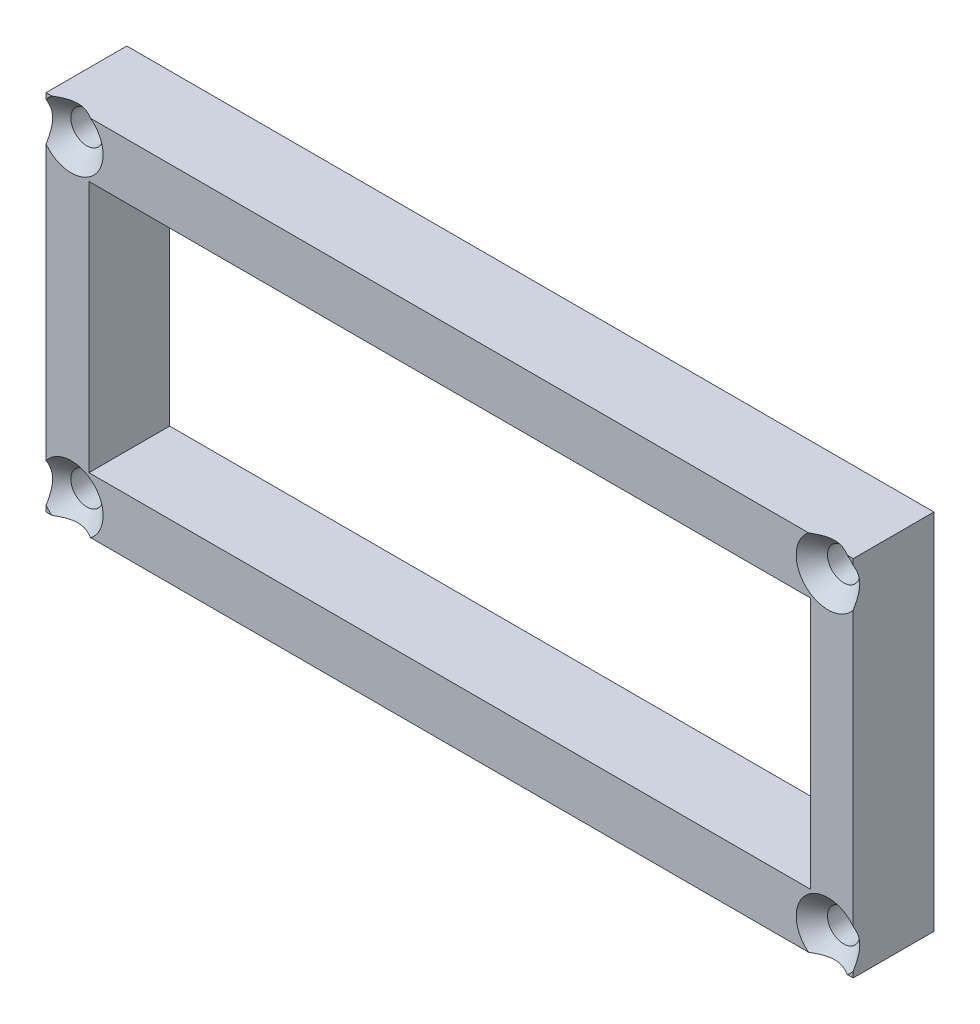
from build123d import *

# Parameters (mm, degrees)
SKETCH2_W                                       = 80
SKETCH2_H                                       = 36
BOSS_EXTRUDE2_DEPTH                             = 8
SKETCH3_W                                       = 71.5
SKETCH3_H                                       = 25
CUT_EXTRUDE1_DEPTH                              = 8
CSK_FOR_M3_FLAT_HEAD_MACHINE_SCREW1_D           = 3.2
CSK_FOR_M3_FLAT_HEAD_MACHINE_SCREW1_CSINK_D     = 6.3
CSK_FOR_M3_FLAT_HEAD_MACHINE_SCREW1_CSINK_ANGLE = 90
CUT_EXTRUDE2_DEPTH                              = 45.586993619
CUT_EXTRUDE2_DEPTH_BACK                         = 3.5


with BuildPart() as part:
    # Sketch2 → Boss-Extrude2 (new body)
    with BuildSketch(Plane.XY):
        Rectangle(SKETCH2_W, SKETCH2_H)
    extrude(amount=BOSS_EXTRUDE2_DEPTH)

    # Sketch3 → Cut-Extrude1 (cut)
    with BuildSketch(Plane.XY.offset(8)):
        Rectangle(SKETCH3_W, SKETCH3_H)
    extrude(amount=-CUT_EXTRUDE1_DEPTH, mode=Mode.SUBTRACT)

    # CSK for M3 Flat Head Machine Screw1 (through all)
    with Locations(Plane.XY.offset(8)):
        with Locations((-37.5, 15.5), (-37.5, -15.5), (37.5, 15.5), (37.5, -15.5)):
            CounterSinkHole(CSK_FOR_M3_FLAT_HEAD_MACHINE_SCREW1_D / 2, CSK_FOR_M3_FLAT_HEAD_MACHINE_SCREW1_CSINK_D / 2, counter_sink_angle=CSK_FOR_M3_FLAT_HEAD_MACHINE_SCREW1_CSINK_ANGLE)

    # Sketch7 → Cut-Extrude2 (cut, two sides: drawn at the far end of the back side and taken through both)
    with BuildSketch(Plane(origin=(0, 0, 0), x_dir=(-1, 0, 0), z_dir=(0, 0, -1)).offset(-CUT_EXTRUDE2_DEPTH_BACK)):
        Polygon((-35.75, -8.5), (-35.75, 8.5), (-39.75, 6.5), (-39.75, -6.5), align=None)
    extrude(amount=CUT_EXTRUDE2_DEPTH + CUT_EXTRUDE2_DEPTH_BACK, mode=Mode.SUBTRACT)


solid = part.part
